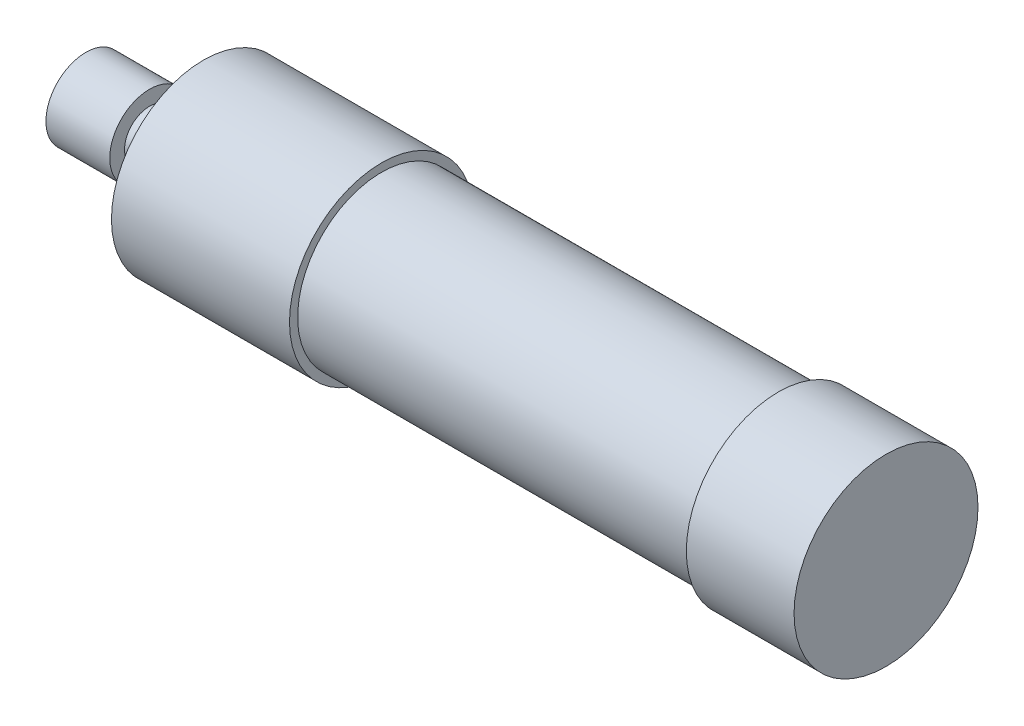
from build123d import *

# Parameters (mm, degrees)
CIRPATTERN1_COUNT = 4


with BuildPart() as part:
    # Sketch1 → Revolve1 (revolve)
    with BuildSketch(Plane.XY, mode=Mode.PRIVATE) as revolve1_sk:
        Polygon((-95.584028604, 0), (-95.584028604, 4.7625), (-87.964028604, 4.7625), (-87.964028604, 2.9972), (-84.790088556, 2.9972), (-84.790088556, 6.0071), (-81.534, 6.0071), (-81.534, 10.9855), (-60.269072576, 10.9855), (-60.269072576, 10.013003393), (-12.869596711, 10.013003393), (-12.869596711, 10.9855), (0, 10.9855), (0, 0), align=None)
    revolve(revolve1_sk.sketch.rotate(Axis((0, 0, 0), (-1, 0, 0)), 90), axis=Axis((0, 0, 0), (-1, 0, 0)))

    # Sketch3 → M3x0.5 Tapped Hole1 (revolve, cut)
    with BuildSketch(Plane(origin=(-81.534, 9, 0), x_dir=(0, 0, 1), z_dir=(0, 1, 0))):
        Polygon((0, 0), (0, 13.451075774), (1.25, 12.7), (1.25, 0), align=None)
    m3x0_5_tapped_hole1 = revolve(axis=Axis((-87.884, 9, 0), (1, 0, 0)), mode=Mode.SUBTRACT)

    # CirPattern1: M3x0.5 Tapped Hole1 ×4 about axis
    cirpattern1_axis = Axis((0, 0, 0), (1, 0, 0))
    for i in range(1, CIRPATTERN1_COUNT):
        add(m3x0_5_tapped_hole1.rotate(cirpattern1_axis, i * 360 / CIRPATTERN1_COUNT), mode=Mode.SUBTRACT)


solid = part.part
